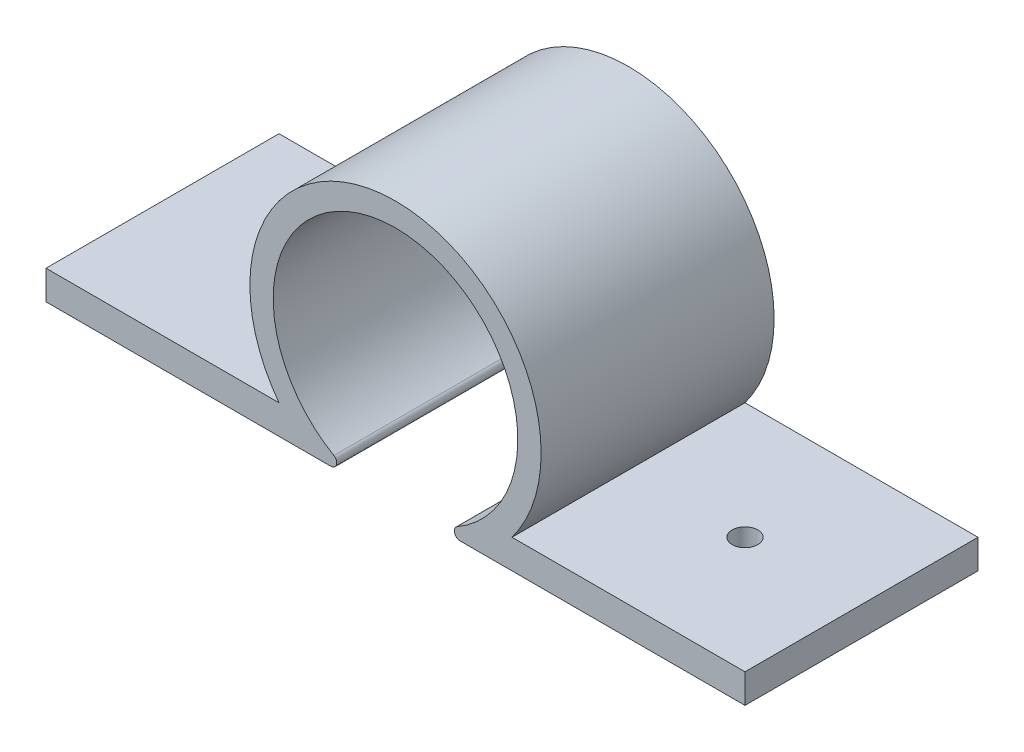
from build123d import *

# Parameters (mm, degrees)
BOSS_EXTRUDE1_DEPTH = 20
SKETCH3_R           = 10.5
CUT_EXTRUDE1_DEPTH  = 42.851672607
SKETCH4_R           = 1.1
CUT_EXTRUDE2_DEPTH  = 2.5
FILLET1_R           = 0.5


with BuildPart() as part:
    # Sketch1 → Boss-Extrude1 (new body)
    with BuildSketch(Plane.XY):
        with BuildLine():
            Line((10, 1.25), (30, 1.25))
            Line((30, 1.25), (30, -1.25))
            Line((30, -1.25), (-30, -1.25))
            Line((-30, -1.25), (-30, 1.25))
            Line((-30, 1.25), (-10, 1.25))
            ThreePointArc((-10, 1.25), (0, 21.25), (10, 1.25))
        make_face()
    extrude(amount=BOSS_EXTRUDE1_DEPTH)

    # Sketch3 → Cut-Extrude1 (cut, through all)
    with BuildSketch(Plane.XY.offset(20)):
        with Locations((0, 8.75)):
            Circle(SKETCH3_R)
    extrude(amount=-CUT_EXTRUDE1_DEPTH, mode=Mode.SUBTRACT)

    # Sketch4 → Cut-Extrude2 (cut)
    with BuildSketch(Plane(origin=(0, 1.25, 0), x_dir=(1, 0, 0), z_dir=(0, 1, 0))):
        with Locations(Location((-20, -10, 0), (0, 0, 270))):
            Circle(SKETCH4_R)
        with Locations(Location((20, -10, 0), (0, 0, 270))):
            Circle(SKETCH4_R)
    extrude(amount=-CUT_EXTRUDE2_DEPTH, mode=Mode.SUBTRACT)

    # Fillet1
    fillet1_edges = [part.edges().sort_by_distance(p)[0] for p in [
        (-3.201562119, -1.25, 10),
        (3.201562119, -1.25, 10),
    ]]
    fillet(fillet1_edges, radius=FILLET1_R)


solid = part.part
